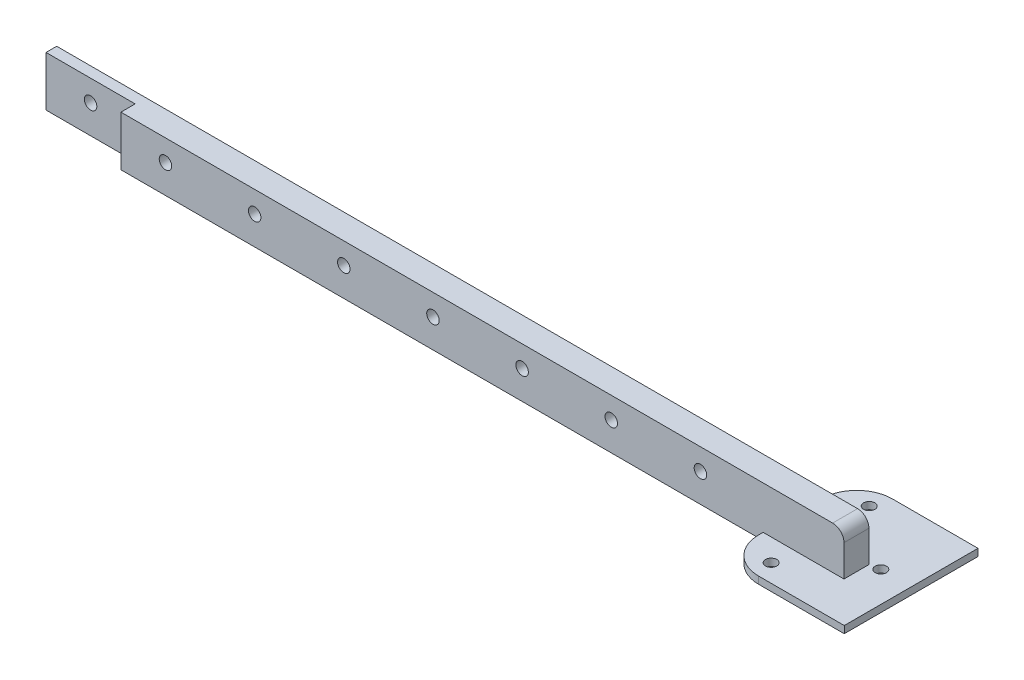
from build123d import *

# Parameters (mm, degrees)
TOPSKETCH1_R                        = 1.59
TOPBOSS_EXTRUDE1_DEPTH              = 2
FILLET1_R                           = 10
LINEARRAILHEIGHTSKETCH2_W           = 227.746666667
LINEARRAILHEIGHTSKETCH2_H           = 7
LINEARRAILHEIGHTBOSS_EXTRUDE2_DEPTH = 12
LINEARRAILHOLESSKETCH3_R            = 1.75
LINEARRAILHOLESCUT_EXTRUDE1_DEPTH   = 208.226612432
CONNECTINGPLATESKETCH1_W            = 25
CONNECTINGPLATESKETCH1_H            = 14
CONNECTINGPLATECUT_EXTRUDE1_DEPTH   = 4
FILLET2_R                           = 3.175


with BuildPart() as part:
    # TopSketch1 → TopBoss-Extrude1 (new body)
    with BuildSketch(Plane(origin=(0, 0, 0), x_dir=(1, 0, 0), z_dir=(0, 1, 0))):
        Polygon((0, 0), (34, 0), (34, 37.5), (0, 37.5), (0, 19.25), (-205.08, 19.25), (-205.08, 11.25), (0, 11.25), align=None)
        with Locations(Location((8.5, 32.5, 0), (0, 0, 270))):
            Circle(TOPSKETCH1_R, mode=Mode.SUBTRACT)
        with Locations(Location((8.5, 5, 0), (0, 0, 270))):
            Circle(TOPSKETCH1_R, mode=Mode.SUBTRACT)
        with Locations(Location((25.5, 18.75, 0), (0, 0, 270))):
            Circle(TOPSKETCH1_R, mode=Mode.SUBTRACT)
    extrude(amount=TOPBOSS_EXTRUDE1_DEPTH)

    # Fillet1
    fillet1_edges = [part.edges().sort_by_distance(p)[0] for p in [
        (0, 1, -37.5),
        (0, 1, 0),
    ]]
    fillet(fillet1_edges, radius=FILLET1_R)

    # LinearRailHEightSketch2 → LinearRailHeightBoss-Extrude2 (add)
    with BuildSketch(Plane(origin=(0, 2, 0), x_dir=(1, 0, 0), z_dir=(0, 1, 0))):
        with Locations((-91.206666667, 14.75)):
            Rectangle(LINEARRAILHEIGHTSKETCH2_W, LINEARRAILHEIGHTSKETCH2_H)
    extrude(amount=LINEARRAILHEIGHTBOSS_EXTRUDE2_DEPTH)

    # LinearRailHolesSketch3 → LinearRailHolesCut-Extrude1 (cut, through all)
    with BuildSketch(Plane.XY.offset(-11.25)):
        with Locations((-192.58, 8)):
            Circle(LINEARRAILHOLESSKETCH3_R)
        with Locations((-167.58, 8)):
            Circle(LINEARRAILHOLESSKETCH3_R)
        with Locations((-142.58, 8)):
            Circle(LINEARRAILHOLESSKETCH3_R)
        with Locations((-117.58, 8)):
            Circle(LINEARRAILHOLESSKETCH3_R)
        with Locations((-92.58, 8)):
            Circle(LINEARRAILHOLESSKETCH3_R)
        with Locations((-67.58, 8)):
            Circle(LINEARRAILHOLESSKETCH3_R)
        with Locations((-42.58, 8)):
            Circle(LINEARRAILHOLESSKETCH3_R)
        with Locations((-17.58, 8)):
            Circle(LINEARRAILHOLESSKETCH3_R)
    extrude(amount=-LINEARRAILHOLESCUT_EXTRUDE1_DEPTH, mode=Mode.SUBTRACT)

    # ConnectingPlateSketch1 → ConnectingPlateCut-Extrude1 (cut)
    with BuildSketch(Plane.XY.offset(-11.25)):
        with Locations((-192.58, 7)):
            Rectangle(CONNECTINGPLATESKETCH1_W, CONNECTINGPLATESKETCH1_H)
    extrude(amount=-CONNECTINGPLATECUT_EXTRUDE1_DEPTH, mode=Mode.SUBTRACT)

    # Fillet2
    fillet2_edges = [part.edges().sort_by_distance(p)[0] for p in [
        (22.666666667, 14, -14.75),
    ]]
    fillet(fillet2_edges, radius=FILLET2_R)


solid = part.part
